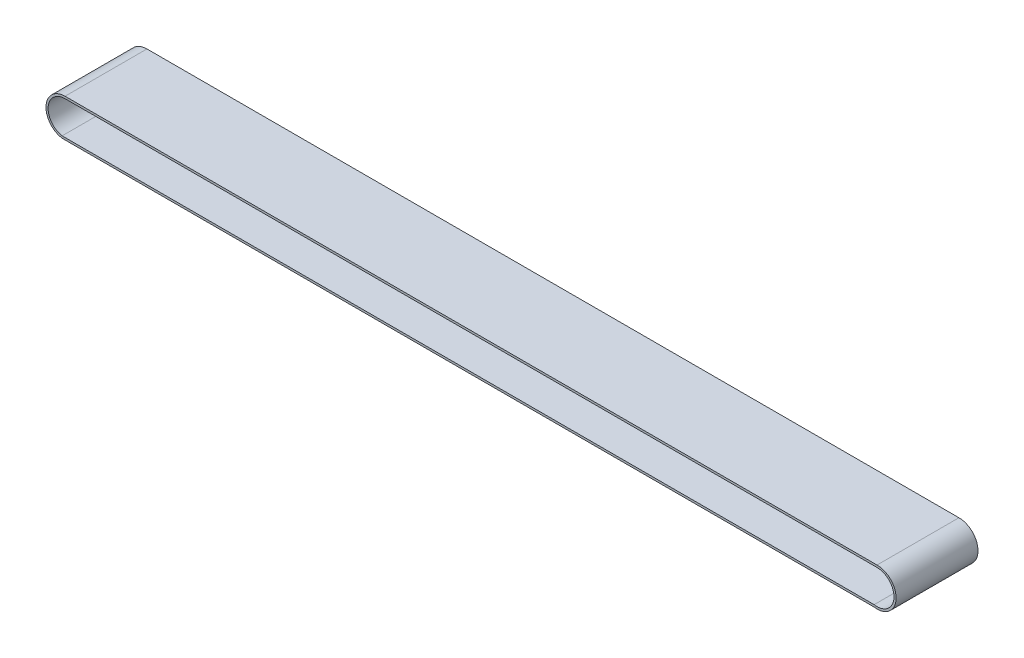
from build123d import *

# Parameters (mm, degrees)
SALIENTE_EXTRUIR1_DEPTH = 29
VACIADO3_T              = -1.5


with BuildPart() as part:
    # Croquis1 → Saliente-Extruir1 (new, symmetric)
    with BuildSketch(Plane.XY):
        with BuildLine():
            Line((-288.592886812, -13.410938253), (286.407113188, -13.410938253))
            ThreePointArc((286.407113188, -13.410938253), (302.048282251, -1.185571473), (288.592886812, 13.410938253))
            Line((288.592886812, 13.410938253), (-286.407113188, 13.410938253))
            ThreePointArc((-286.407113188, 13.410938253), (-299.862508627, 1.00744798), (-288.592886812, -13.410938253))
        make_face()
    extrude(amount=SALIENTE_EXTRUIR1_DEPTH, both=True)

    # Vaciado3
    vaciado3_openings = [part.faces().sort_by_distance(p)[0] for p in [
        (1.102229912, -0.003188018, 29),
        (1.102229912, -0.003188018, -29),
    ]]
    offset(amount=VACIADO3_T, openings=vaciado3_openings, kind=Kind.INTERSECTION)


solid = part.part
